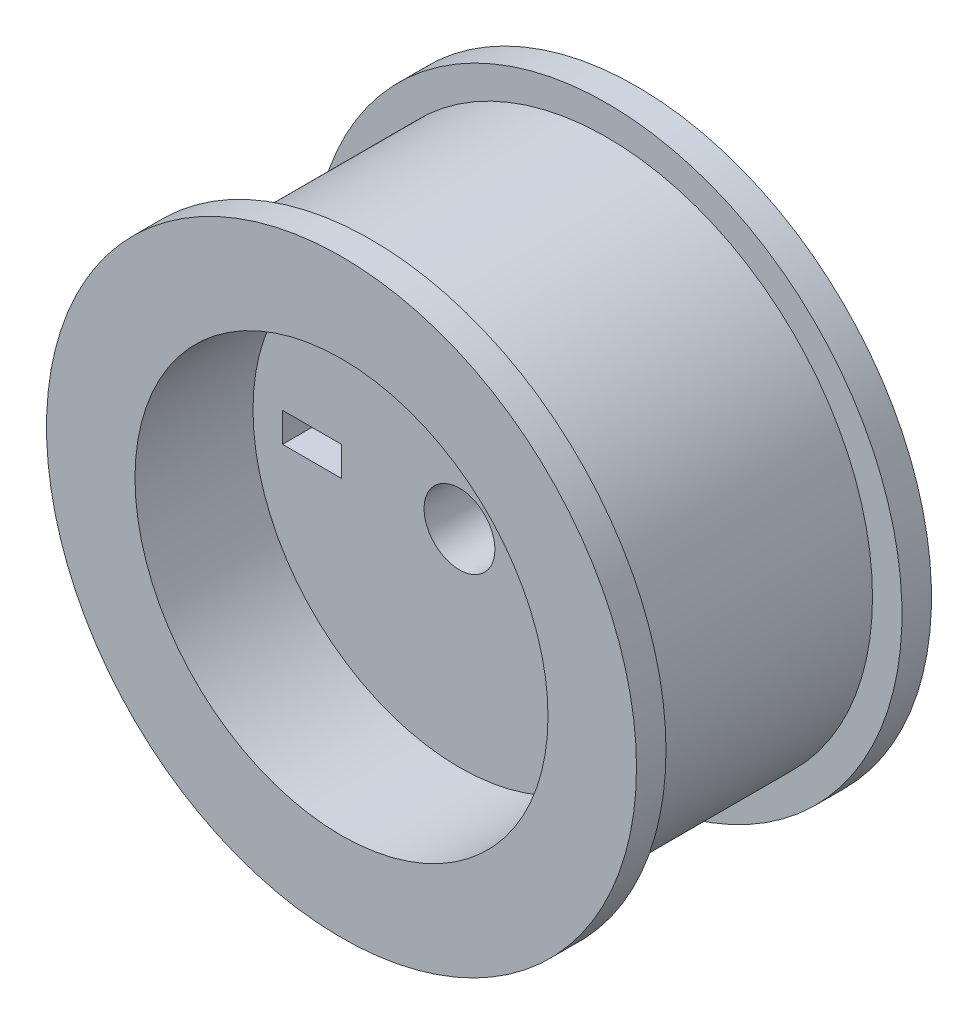
from build123d import *

# Parameters (mm, degrees)
SKETCH1_R           = 45
BOSS_EXTRUDE1_DEPTH = 40
SKETCH2_R           = 50
BOSS_EXTRUDE2_DEPTH = 5
BOSS_EXTRUDE3_START = 5
SKETCH3_R           = 50
BOSS_EXTRUDE3_DEPTH = 5
SKETCH4_R           = 35
CUT_EXTRUDE1_DEPTH  = 20
CUT_EXTRUDE2_START  = -20
SKETCH5_R           = 35
CUT_EXTRUDE2_DEPTH  = 20
SKETCH6_R           = 6
CUT_EXTRUDE3_DEPTH  = 20
CUT_EXTRUDE4_DEPTH  = 10


with BuildPart() as part:
    # Sketch1 → Boss-Extrude1 (new body)
    with BuildSketch(Plane.XY):
        Circle(SKETCH1_R)
    extrude(amount=BOSS_EXTRUDE1_DEPTH)

    # Sketch2 → Boss-Extrude2 (add)
    with BuildSketch(Plane.XY.offset(40)):
        Circle(SKETCH2_R)
    extrude(amount=BOSS_EXTRUDE2_DEPTH)

    # Sketch3 → Boss-Extrude3 (add)
    with BuildSketch(Plane(origin=(0, 0, 0), x_dir=(-1, 0, 0), z_dir=(0, 0, -1)).offset(BOSS_EXTRUDE3_START)):
        with Locations(Location((0, 0, 0), (0, 0, 180))):
            Circle(SKETCH3_R)
    extrude(amount=-BOSS_EXTRUDE3_DEPTH)

    # Sketch4 → Cut-Extrude1 (cut)
    with BuildSketch(Plane.XY.offset(45)):
        Circle(SKETCH4_R)
    extrude(amount=-CUT_EXTRUDE1_DEPTH, mode=Mode.SUBTRACT)

    # Sketch5 → Cut-Extrude2 (cut)
    with BuildSketch(Plane(origin=(0, 0, -5), x_dir=(-1, 0, 0), z_dir=(0, 0, -1)).offset(CUT_EXTRUDE2_START)):
        with Locations(Location((0, 0, 0), (0, 0, 180))):
            Circle(SKETCH5_R)
    extrude(amount=CUT_EXTRUDE2_DEPTH, mode=Mode.SUBTRACT)

    # Sketch6 → Cut-Extrude3 (cut)
    with BuildSketch(Plane.XY.offset(25)):
        Circle(SKETCH6_R)
    extrude(amount=-CUT_EXTRUDE3_DEPTH, mode=Mode.SUBTRACT)

    # Sketch7 → Cut-Extrude4 (cut)
    with BuildSketch(Plane.XY.offset(25)):
        Polygon((-20, -0.07309958), (-20, -2.57309958), (-30, -2.57309958), (-30, -0.07309958), (-30, 2.42690042), (-20, 2.42690042), align=None)
    extrude(amount=-CUT_EXTRUDE4_DEPTH, mode=Mode.SUBTRACT)


solid = part.part
